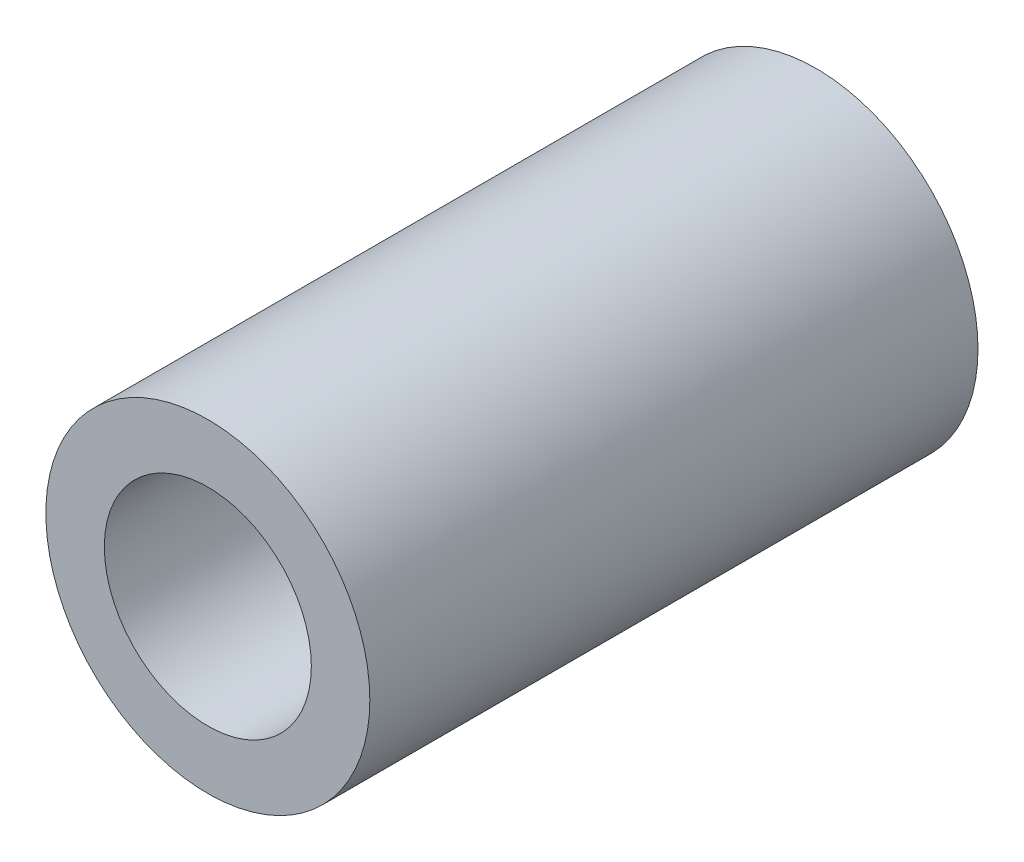
from build123d import *

# Parameters (mm, degrees)
SKETCH_1_R      = 5.54
SKETCH_1_R_2    = 3.54
EXTRUDE_1_DEPTH = 20.8


with BuildPart() as part:
    # 스케치1 → 보스-돌출1 (new body)
    with BuildSketch(Plane.XY):
        Circle(SKETCH_1_R)
        Circle(SKETCH_1_R_2, mode=Mode.SUBTRACT)
    extrude(amount=EXTRUDE_1_DEPTH)


solid = part.part
